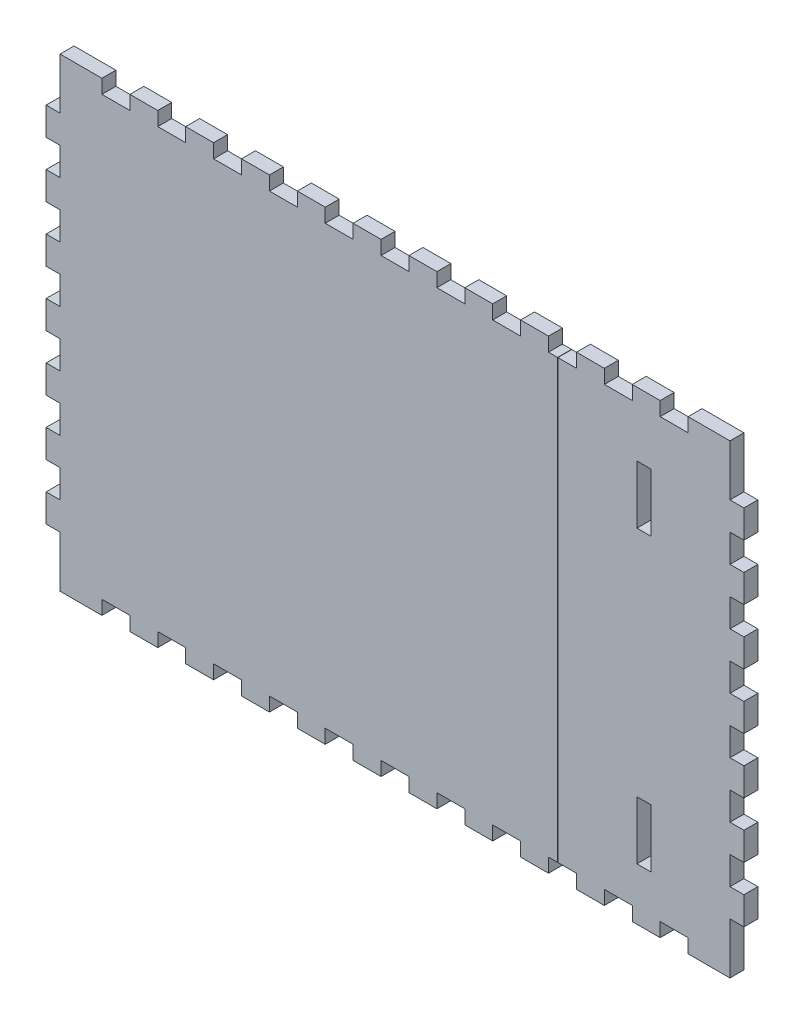
from build123d import *

# Parameters (mm, degrees)
BOSS_EXTRUDE1_DEPTH = 6
SKETCH2_W           = 6
SKETCH2_H           = 25
SKETCH2_W_2         = 0.1
SKETCH2_H_2         = 235.31007752
CUT_EXTRUDE1_DEPTH  = 6


with BuildPart() as part:
    # Model → Boss-Extrude1 (new body)
    with BuildSketch(Plane.XY):
        Polygon((209, 203), (209, 181), (203, 181), (203, 169), (209, 169), (209, 157), (203, 157), (203, 145), (209, 145), (209, 133), (203, 133), (203, 121), (209, 121), (209, 109), (203, 109), (203, 97), (209, 97), (209, 85), (203, 85), (203, 73), (209, 73), (209, 61), (203, 61), (203, 49), (209, 49), (209, 37), (203, 37), (203, 25), (209, 25), (209, 13), (209, 3), (227, 3), (227, 9), (239, 9), (239, 3), (251, 3), (251, 9), (263, 9), (263, 3), (275, 3), (275, 9), (287, 9), (287, 3), (299, 3), (299, 9), (311, 9), (311, 3), (323, 3), (323, 9), (335, 9), (335, 3), (347, 3), (347, 9), (359, 9), (359, 3), (371, 3), (371, 9), (383, 9), (383, 3), (395, 3), (395, 9), (407, 9), (407, 3), (419, 3), (419, 9), (431, 9), (431, 3), (443, 3), (443, 9), (455, 9), (455, 3), (467, 3), (467, 9), (479, 9), (479, 3), (491, 3), (497, 3), (497, 25), (503, 25), (503, 37), (497, 37), (497, 49), (503, 49), (503, 61), (497, 61), (497, 73), (503, 73), (503, 85), (497, 85), (497, 97), (503, 97), (503, 109), (497, 109), (497, 121), (503, 121), (503, 133), (497, 133), (497, 145), (503, 145), (503, 157), (497, 157), (497, 169), (503, 169), (503, 181), (497, 181), (497, 193), (497, 203), (479, 203), (479, 197), (467, 197), (467, 203), (455, 203), (455, 197), (443, 197), (443, 203), (431, 203), (431, 197), (419, 197), (419, 203), (407, 203), (407, 197), (395, 197), (395, 203), (383, 203), (383, 197), (371, 197), (371, 203), (359, 203), (359, 197), (347, 197), (347, 203), (335, 203), (335, 197), (323, 197), (323, 203), (311, 203), (311, 197), (299, 197), (299, 203), (287, 203), (287, 197), (275, 197), (275, 203), (263, 203), (263, 197), (251, 197), (251, 203), (239, 203), (239, 197), (227, 197), (227, 203), (215, 203), align=None)
    extrude(amount=BOSS_EXTRUDE1_DEPTH)

    # Sketch2 → Cut-Extrude1 (cut)
    with BuildSketch(Plane.XY.offset(6)):
        with Locations((460, 38)):
            Rectangle(SKETCH2_W, SKETCH2_H)
        with Locations((422.95, 100.5)):
            Rectangle(SKETCH2_W_2, SKETCH2_H_2)
        with Locations((460, 163)):
            Rectangle(SKETCH2_W, SKETCH2_H)
    extrude(amount=-CUT_EXTRUDE1_DEPTH, mode=Mode.SUBTRACT)


with BuildPart() as cut_extrude1_piece_1:
    # of the separate pieces the step leaves, piece 1, a body of its own (cut_extrude1_pieces)
    add(part.part.solids().sort_by_distance((209, 203, 0))[0])


with BuildPart() as cut_extrude1_piece_2:
    # of the separate pieces the step leaves, piece 2, a body of its own (cut_extrude1_pieces)
    add(part.part.solids().sort_by_distance((431, 197, 0))[0])


solid = Compound([cut_extrude1_piece_1.part, cut_extrude1_piece_2.part])
